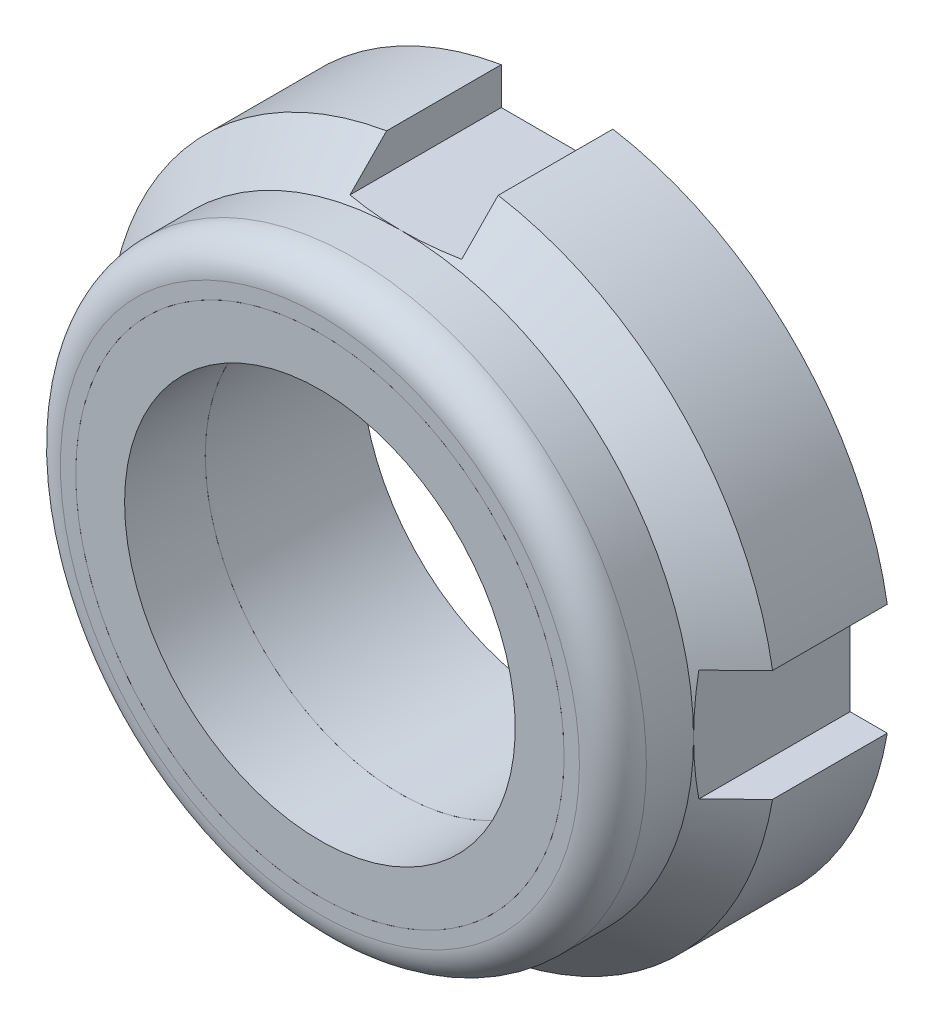
from build123d import *

# Parameters (mm, degrees)
BOSS_EXTRUDE1_DEPTH      = 4.25
BOSS_EXTRUDE1_DEPTH_BACK = 4.25
SKETCH4_R                = 12
SKETCH4_R_2              = 7
SKETCH5_R                = 12
SKETCH5_R_2              = 10.5
CUT_EXTRUDE1_DEPTH       = 0.5
SKETCH16_W               = 4
SKETCH16_H               = 1.5
CUT_EXTRUDE7_DEPTH       = 18.494642037
CIRPATTERN1_COUNT        = 4
FILLET1_R                = 1.2
SKETCH19_R               = 8.75
CUT_EXTRUDE8_DEPTH       = 2.89
SKETCH20_R               = 8.75
SKETCH20_R_2             = 7
BOSS_EXTRUDE2_DEPTH      = 2.89


with BuildPart() as part:
    # Sketch4 → Boss-Extrude1 (new, two sides: drawn at the far end of the back side and taken through both)
    with BuildSketch(Plane.XY.offset(-BOSS_EXTRUDE1_DEPTH_BACK)):
        Circle(SKETCH4_R)
        Circle(SKETCH4_R_2, mode=Mode.SUBTRACT)
    extrude(amount=BOSS_EXTRUDE1_DEPTH + BOSS_EXTRUDE1_DEPTH_BACK)

    # Sketch5 → Cut-Extrude1 (cut)
    with BuildSketch(Plane.XY.offset(4.25)):
        Circle(SKETCH5_R)
        Circle(SKETCH5_R_2, mode=Mode.SUBTRACT)
    extrude(amount=-CUT_EXTRUDE1_DEPTH, mode=Mode.SUBTRACT)

    # Sketch16 → Cut-Extrude7 (cut, symmetric)
    with BuildSketch(Plane.XY):
        with Locations((0, -11.25)):
            Rectangle(SKETCH16_W, SKETCH16_H)
    cut_extrude7 = extrude(amount=CUT_EXTRUDE7_DEPTH, both=True, mode=Mode.SUBTRACT)

    # CirPattern1: Cut-Extrude7 ×4 about axis
    cirpattern1_axis = Axis((0, 0, 0), (0, 0, 1))
    for i in range(1, CIRPATTERN1_COUNT):
        add(cut_extrude7.rotate(cirpattern1_axis, i * 360 / CIRPATTERN1_COUNT), mode=Mode.SUBTRACT)

    # Sketch18 → Cut-Revolve1 (revolve, cut)
    with BuildSketch(Plane(origin=(0, 0, 0), x_dir=(0, 0, -1), z_dir=(1, 0, 0)), mode=Mode.PRIVATE) as cut_revolve1_sk:
        Polygon((-1.36, 10.5), (0.14, 12), (-4.25, 12), (-4.25, 10.5), align=None)
    revolve(cut_revolve1_sk.sketch.rotate(Axis((0, 0, 4.25), (0, 0, -1)), 90), axis=Axis((0, 0, 4.25), (0, 0, -1)), mode=Mode.SUBTRACT)

    # Fillet1
    fillet1_edges = [part.edges().sort_by_distance(p)[0] for p in [
        (-10.5, 0, 4.25),
    ]]
    fillet(fillet1_edges, radius=FILLET1_R)

    # Sketch19 → Cut-Extrude8 (cut)
    with BuildSketch(Plane.XY.offset(4.25)):
        Circle(SKETCH19_R)
    extrude(amount=-CUT_EXTRUDE8_DEPTH, mode=Mode.SUBTRACT)


with BuildPart() as body_2:
    # Sketch20 → Boss-Extrude2 (new body)
    with BuildSketch(Plane.XY.offset(1.36)):
        with Locations(Location((0, 0, 0), (0, 0, 180))):
            Circle(SKETCH20_R)
        with Locations(Location((0, 0, 0), (0, 0, 180))):
            Circle(SKETCH20_R_2, mode=Mode.SUBTRACT)
    extrude(amount=BOSS_EXTRUDE2_DEPTH)


solid = Compound([part.part, body_2.part])
